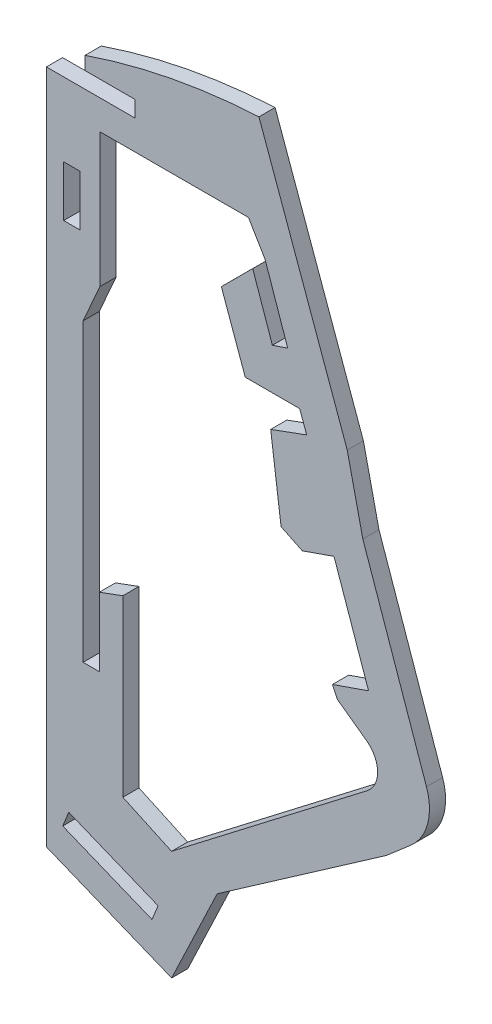
from build123d import *

# Parameters (mm, degrees)
SKETCH1_W           = 3
SKETCH1_H           = 9.45
BASE_EXTRUDE_DEPTH  = 3
SKETCH2_W           = 10
SKETCH2_H           = 3
BOSS_EXTRUDE1_DEPTH = 3


with BuildPart() as part:
    # Sketch1 → Base-Extrude (new body)
    with BuildSketch(Plane.XY):
        with BuildLine():
            Line((1079.876919763, -44.105153511), (1068.056216666, -10.172974917))
            Line((1068.056216666, -10.172974917), (1065.157526034, 2.696840543))
            Line((1065.157526034, 2.696840543), (1048.759611565, 48.101577381))
            ThreePointArc((1048.759611565, 48.101577381), (1032.394850119, 46.101647559), (1016.466345621, 41.848662618))
            Line((1016.466345621, 41.848662618), (1016.466345621, 39.392602571))
            Line((1016.466345621, 39.392602571), (1035.726137056, 39.392602571))
            Line((1035.726137056, 39.392602571), (1035.726137056, 36.392602571))
            Line((1035.726137056, 36.392602571), (1009.279499751, 36.392602571))
            Line((1009.279499751, 36.392602571), (1009.279499751, -89.073987735))
            Line((1009.279499751, -89.073987735), (1032.543515661, -98.536722682))
            Line((1032.543515661, -98.536722682), (1040.991113984, -80.770341528))
            Line((1040.991113984, -80.770341528), (1072.440441541, -58.876157059))
            Line((1072.440441541, -58.876157059), (1076.9710582, -54.961956755))
            ThreePointArc((1076.9710582, -54.961956755), (1080.093496996, -49.980404823), (1079.876919763, -44.105153511))
        make_face()
        with BuildLine():
            Line((1019.213878108, 30.925856164), (1019.213878108, 6.018771541))
            Line((1019.213878108, 6.018771541), (1016.100082492, -1.038872257))
            Line((1016.100082492, -1.038872257), (1016.100082492, -55.976738358))
            Line((1016.100082492, -55.976738358), (1019.100082492, -55.976738358))
            Line((1019.100082492, -55.976738358), (1019.100082492, -43.198135443))
            Line((1019.100082492, -43.198135443), (1023.478597046, -41.580404808))
            Line((1023.478597046, -41.580404808), (1023.478597046, -73.992128786))
            Line((1023.478597046, -73.992128786), (1032.526582577, -78.167039678))
            Line((1032.526582577, -78.167039678), (1068.850484509, -50.258348586))
            ThreePointArc((1068.850484509, -50.258348586), (1070.803657728, -46.221334872), (1068.734776871, -42.242378056))
            Line((1068.734776871, -42.242378056), (1063.325122863, -38.329012558))
            Line((1063.325122863, -38.329012558), (1062.407393196, -36.386031272))
            Line((1062.407393196, -36.386031272), (1069.115709638, -34.04910449))
            Line((1069.115709638, -34.04910449), (1062.700744223, -15.634484789))
            Line((1062.700744223, -15.634484789), (1056.810312455, -17.686491112))
            Line((1056.810312455, -17.686491112), (1052.869598475, -15.779326268))
            Line((1052.869598475, -15.779326268), (1050.941521122, -1.083078235))
            Line((1050.941521122, -1.083078235), (1057.625060998, 1.362146575))
            Line((1057.625060998, 1.362146575), (1056.321001716, 4.948397029))
            Line((1056.321001716, 4.948397029), (1046.214175082, 4.948397029))
            Line((1046.214175082, 4.948397029), (1041.773169547, 17.294470752))
            Line((1041.773169547, 17.294470752), (1047.600835278, 23.111994965))
            Line((1047.600835278, 23.111994965), (1051.253809923, 12.605592538))
            Line((1051.253809923, 12.605592538), (1054.100349004, 13.552807012))
            Line((1054.100349004, 13.552807012), (1049.909104568, 25.720739733))
            Line((1049.909104568, 25.720739733), (1046.816291402, 30.939914406))
            Line((1046.816291402, 30.939914406), (1019.213878108, 30.925856164))
        make_face(mode=Mode.SUBTRACT)
        Polygon((1012.307844389, -84.207250741), (1013.438177941, -81.428339792), (1030.025357256, -88.175243766), (1028.895023704, -90.954154714), align=None, mode=Mode.SUBTRACT)
        with Locations((1013.982987836, 18.006853638)):
            Rectangle(SKETCH1_W, SKETCH1_H, mode=Mode.SUBTRACT)
    extrude(amount=BASE_EXTRUDE_DEPTH)

    # Sketch2 → Boss-Extrude1 (add)
    with BuildSketch(Plane.XY.offset(3)):
        with Locations((1030.726137056, 37.892602571)):
            Rectangle(SKETCH2_W, SKETCH2_H)
    extrude(amount=-BOSS_EXTRUDE1_DEPTH)


solid = part.part
